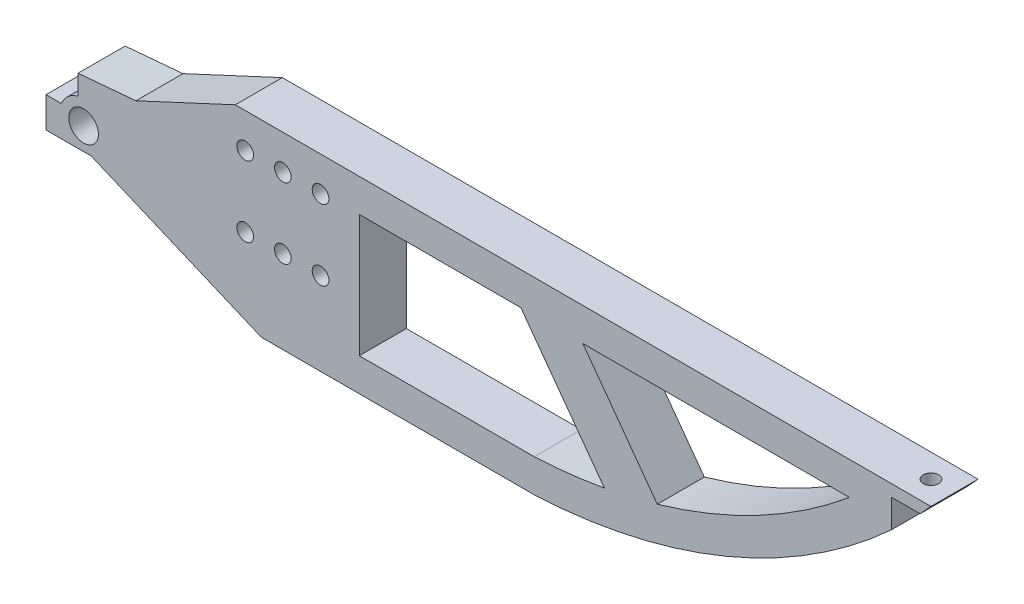
from build123d import *

# Parameters (mm, degrees)
SKETCH1_W             = 241.3
SKETCH1_H             = 50.8
BOSS_EXTRUDE1_DEPTH   = 12.7
SKETCH3_R             = 4
CUT_EXTRUDE1_DEPTH    = 124.947055229
CUT_EXTRUDE2_DEPTH    = 124.947055229
F_8_CLEARANCE_HOLE1_D = 4.4958
SKETCH10_R            = 1.905
CUT_EXTRUDE3_DEPTH    = 5.08
BOSS_EXTRUDE2_DEPTH   = 12.7
CUT_EXTRUDE4_DEPTH    = 124.947055239
SKETCH14_R            = 1.27
CUT_EXTRUDE5_DEPTH    = 6.35
SKETCH15_W            = 7.607640742
SKETCH15_H            = 9.409671306
CUT_EXTRUDE6_DEPTH    = 124.947055239
SKETCH16_W            = 0.104572849
SKETCH16_H            = 0.14582332
CUT_EXTRUDE8_DEPTH    = 124.947055239
SKETCH18_R            = 2.0828
CUT_EXTRUDE9_DEPTH    = 132.523201385
LPATTERN1_COUNT       = 3
LPATTERN1_PITCH       = 10.16


with BuildPart() as part:
    # Sketch1 → Boss-Extrude1 (new body)
    with BuildSketch(Plane.XY):
        Rectangle(SKETCH1_W, SKETCH1_H)
    extrude(amount=BOSS_EXTRUDE1_DEPTH)

    # Sketch3 → Cut-Extrude1 (cut, through all)
    with BuildSketch(Plane.XY.offset(12.7)):
        with Locations((-107.95, 0)):
            Circle(SKETCH3_R)
    extrude(amount=-CUT_EXTRUDE1_DEPTH, mode=Mode.SUBTRACT)

    # Sketch5 → Cut-Extrude2 (cut, through all)
    with BuildSketch(Plane.XY.offset(12.7)):
        with BuildLine():
            Line((-59.990308431, -25.4), (-105.894198974, -6.008009832))
            Line((-105.894198974, -6.008009832), (-109.958209517, -6.024084539))
            Line((-109.958209517, -6.024084539), (-118.086209517, -6.024084539))
            Line((-118.086209517, -6.024084539), (-118.086209517, 2.230915461))
            Line((-118.086209517, 2.230915461), (-113.895209517, 2.230915461))
            ThreePointArc((-113.895209517, 2.230915461), (-111.566364668, 5.219617475), (-107.95, 6.35))
            Line((-107.95, 6.35), (-67.015128773, 25.4))
            Line((-67.015128773, 25.4), (-120.65, 25.4))
            Line((-120.65, 25.4), (-120.65, -25.4))
            Line((-120.65, -25.4), (-59.990308431, -25.4))
        make_face()
        with BuildLine():
            Line((120.65, -25.4), (120.65, 25.4))
            ThreePointArc((120.65, 25.4), (72.371753541, -10.785174559), (13.834903468, -25.4))
            Line((13.834903468, -25.4), (120.65, -25.4))
        make_face()
    extrude(amount=-CUT_EXTRUDE2_DEPTH, mode=Mode.SUBTRACT)

    # #8 Clearance Hole1 (through all)
    with Locations(Plane(origin=(0, 0, 0), x_dir=(-1, 0, 0), z_dir=(0, 0, -1))):
        with Locations((44.020428639, 16.052306877), (44.020428639, -2.997693123)):
            f_8_clearance_hole1 = Hole(F_8_CLEARANCE_HOLE1_D / 2)

    # Sketch10 → Cut-Extrude3 (cut)
    with BuildSketch(Plane.ZY.offset(114.3)):
        with Locations((6.089367744, 0)):
            Circle(SKETCH10_R)
    extrude(amount=-CUT_EXTRUDE3_DEPTH, mode=Mode.SUBTRACT)

    # Sketch11 → Boss-Extrude2 (add)
    with BuildSketch(Plane.XY.offset(12.7)):
        Polygon((-93.824923554, 12.923434781), (-109.445923554, 5.653836977), (-109.445923554, 11.556774368), align=None)
    extrude(amount=-BOSS_EXTRUDE2_DEPTH)

    # Sketch12 → Cut-Extrude4 (cut, through all)
    with BuildSketch(Plane.XY.offset(12.7)):
        with BuildLine():
            Line((10.021655843, 16.51), (-33.573281826, 16.51))
            Line((-33.573281826, 16.51), (-33.573281826, -16.51))
            Line((-33.573281826, -16.51), (13.63000586, -16.51))
            ThreePointArc((13.63000586, -16.51), (23.12933387, -15.748429471), (32.557173193, -14.358081305))
            Line((32.557173193, -14.358081305), (10.021655843, 16.51))
        make_face()
        with BuildLine():
            Line((26.733875346, 16.51), (46.823064271, -11.007216822))
            ThreePointArc((46.823064271, -11.007216822), (74.177600846, 0.070720235), (98.687628211, 16.51))
            Line((98.687628211, 16.51), (26.733875346, 16.51))
        make_face()
    extrude(amount=-CUT_EXTRUDE4_DEPTH, mode=Mode.SUBTRACT)

    # Sketch14 → Cut-Extrude5 (cut)
    with BuildSketch(Plane(origin=(0.022106899, -5.589070571, 0), x_dir=(0.9999921775754317, 0.003955349282477503, 0), z_dir=(0.003955349282477503, -0.9999921775754317, 0))):
        with Locations((-107.949155569, 6.35)):
            Circle(SKETCH14_R)
    extrude(amount=-CUT_EXTRUDE5_DEPTH, mode=Mode.SUBTRACT)

    # Sketch15 → Cut-Extrude6 (cut, through all)
    with BuildSketch(Plane.XY.offset(12.7)):
        with Locations((113.836536756, 17.520164347)):
            Rectangle(SKETCH15_W, SKETCH15_H)
    extrude(amount=-CUT_EXTRUDE6_DEPTH, mode=Mode.SUBTRACT)

    # Sketch16 → Cut-Extrude8 (cut, through all)
    with BuildSketch(Plane.XY.offset(12.7)):
        with Locations((117.692643551, 22.15208834)):
            Rectangle(SKETCH16_W, SKETCH16_H)
    extrude(amount=-CUT_EXTRUDE8_DEPTH, mode=Mode.SUBTRACT)

    # Sketch18 → Cut-Extrude9 (cut, through all)
    with BuildSketch(Plane(origin=(0, 25.4, 0), x_dir=(1, 0, 0), z_dir=(0, 1, 0))):
        with Locations(Location((114.3, -6.35, 0), (0, 0, 180))):
            Circle(SKETCH18_R)
    extrude(amount=-CUT_EXTRUDE9_DEPTH, mode=Mode.SUBTRACT)

    # LPattern1: #8 Clearance Hole1 ×3
    with Locations(*[(-i * LPATTERN1_PITCH, 0, 0) for i in range(1, LPATTERN1_COUNT)]):
        add(f_8_clearance_hole1, mode=Mode.SUBTRACT)


solid = part.part
